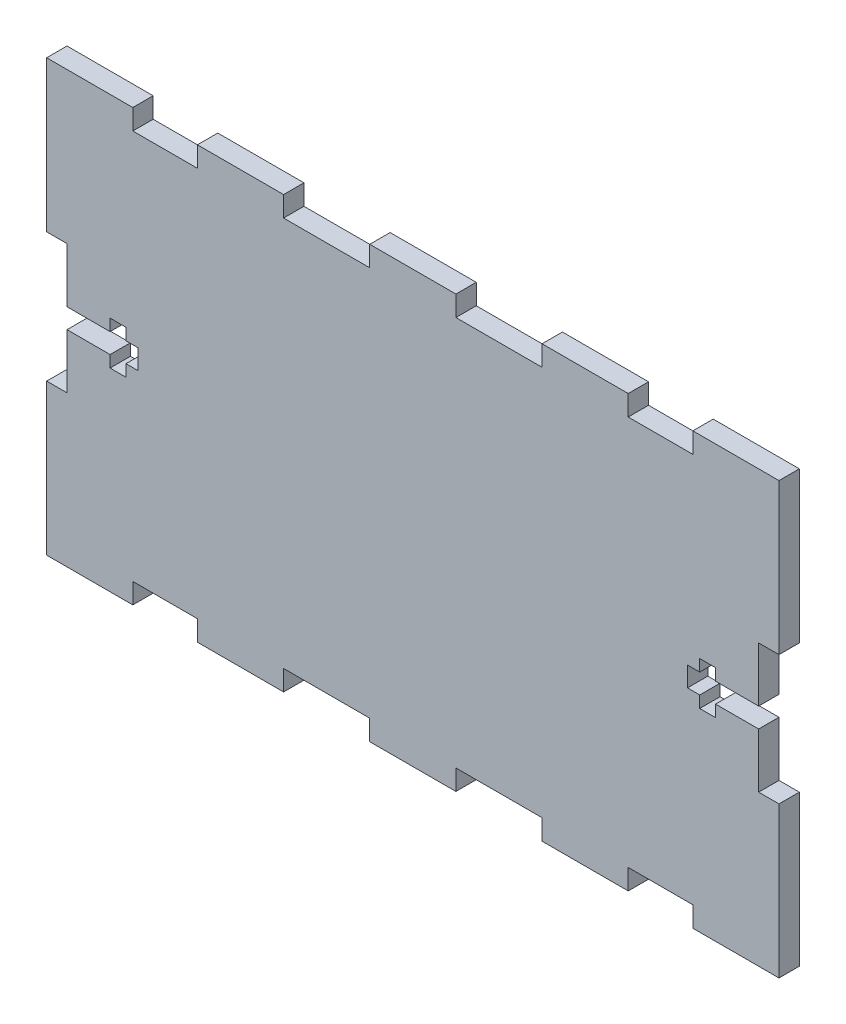
from build123d import *

# Parameters (mm, degrees)
SKETCH1_W           = 107.95
SKETCH1_H           = 63.5
BOSS_EXTRUDE1_DEPTH = 3
CUT_EXTRUDE1_REACH  = 127.278
SKETCH2_W           = 12.7
SKETCH2_H           = 3
SKETCH2_W_2         = 9.525
SKETCH2_W_3         = 3
SKETCH2_H_2         = 19.05
CUT_EXTRUDE2_REACH  = 127.278


with BuildPart() as part:
    # Sketch1 → Boss-Extrude1 (new body)
    with BuildSketch(Plane.XY):
        with Locations((53.975, 31.75)):
            Rectangle(SKETCH1_W, SKETCH1_H)
    extrude(amount=BOSS_EXTRUDE1_DEPTH)

    # Sketch2 → Cut-Extrude1 (cut, up to next)
    with BuildSketch(Plane(origin=(0, 0, 0), x_dir=(-1, 0, 0), z_dir=(0, 0, -1)), mode=Mode.PRIVATE) as cut_extrude1_sk1:
        with Locations((-66.675, 1.5)):
            Rectangle(SKETCH2_W, SKETCH2_H)
    cut_extrude1_tool1 = extrude(cut_extrude1_sk1.sketch, amount=-CUT_EXTRUDE1_REACH, mode=Mode.PRIVATE) & part.part
    # Sketch2 → Cut-Extrude1 (cut, up to next)
    with BuildSketch(Plane(origin=(0, 0, 0), x_dir=(-1, 0, 0), z_dir=(0, 0, -1)), mode=Mode.PRIVATE) as cut_extrude1_sk2:
        with Locations((-17.4625, 1.5)):
            Rectangle(SKETCH2_W_2, SKETCH2_H)
    cut_extrude1_tool2 = extrude(cut_extrude1_sk2.sketch, amount=-CUT_EXTRUDE1_REACH, mode=Mode.PRIVATE) & part.part
    # Sketch2 → Cut-Extrude1 (cut, up to next)
    with BuildSketch(Plane(origin=(0, 0, 0), x_dir=(-1, 0, 0), z_dir=(0, 0, -1)), mode=Mode.PRIVATE) as cut_extrude1_sk3:
        with Locations((-90.4875, 1.5)):
            Rectangle(SKETCH2_W_2, SKETCH2_H)
    cut_extrude1_tool3 = extrude(cut_extrude1_sk3.sketch, amount=-CUT_EXTRUDE1_REACH, mode=Mode.PRIVATE) & part.part
    # Sketch2 → Cut-Extrude1 (cut, up to next)
    with BuildSketch(Plane(origin=(0, 0, 0), x_dir=(-1, 0, 0), z_dir=(0, 0, -1)), mode=Mode.PRIVATE) as cut_extrude1_sk4:
        with Locations((-41.275, 1.5)):
            Rectangle(SKETCH2_W, SKETCH2_H)
    cut_extrude1_tool4 = extrude(cut_extrude1_sk4.sketch, amount=-CUT_EXTRUDE1_REACH, mode=Mode.PRIVATE) & part.part
    # Sketch2 → Cut-Extrude1 (cut, up to next)
    with BuildSketch(Plane(origin=(0, 0, 0), x_dir=(-1, 0, 0), z_dir=(0, 0, -1)), mode=Mode.PRIVATE) as cut_extrude1_sk5:
        with Locations((-41.275, 62)):
            Rectangle(SKETCH2_W, SKETCH2_H)
    cut_extrude1_tool5 = extrude(cut_extrude1_sk5.sketch, amount=-CUT_EXTRUDE1_REACH, mode=Mode.PRIVATE) & part.part
    # Sketch2 → Cut-Extrude1 (cut, up to next)
    with BuildSketch(Plane(origin=(0, 0, 0), x_dir=(-1, 0, 0), z_dir=(0, 0, -1)), mode=Mode.PRIVATE) as cut_extrude1_sk6:
        with Locations((-66.675, 62)):
            Rectangle(SKETCH2_W, SKETCH2_H)
    cut_extrude1_tool6 = extrude(cut_extrude1_sk6.sketch, amount=-CUT_EXTRUDE1_REACH, mode=Mode.PRIVATE) & part.part
    # Sketch2 → Cut-Extrude1 (cut, up to next)
    with BuildSketch(Plane(origin=(0, 0, 0), x_dir=(-1, 0, 0), z_dir=(0, 0, -1)), mode=Mode.PRIVATE) as cut_extrude1_sk7:
        with Locations((-17.4625, 62)):
            Rectangle(SKETCH2_W_2, SKETCH2_H)
    cut_extrude1_tool7 = extrude(cut_extrude1_sk7.sketch, amount=-CUT_EXTRUDE1_REACH, mode=Mode.PRIVATE) & part.part
    # Sketch2 → Cut-Extrude1 (cut, up to next)
    with BuildSketch(Plane(origin=(0, 0, 0), x_dir=(-1, 0, 0), z_dir=(0, 0, -1)), mode=Mode.PRIVATE) as cut_extrude1_sk8:
        with Locations((-106.45, 31.75)):
            Rectangle(SKETCH2_W_3, SKETCH2_H_2)
    cut_extrude1_tool8 = extrude(cut_extrude1_sk8.sketch, amount=-CUT_EXTRUDE1_REACH, mode=Mode.PRIVATE) & part.part
    # Sketch2 → Cut-Extrude1 (cut, up to next)
    with BuildSketch(Plane(origin=(0, 0, 0), x_dir=(-1, 0, 0), z_dir=(0, 0, -1)), mode=Mode.PRIVATE) as cut_extrude1_sk9:
        with Locations((-1.5, 31.75)):
            Rectangle(SKETCH2_W_3, SKETCH2_H_2)
    cut_extrude1_tool9 = extrude(cut_extrude1_sk9.sketch, amount=-CUT_EXTRUDE1_REACH, mode=Mode.PRIVATE) & part.part
    # Sketch2 → Cut-Extrude1 (cut, up to next)
    with BuildSketch(Plane(origin=(0, 0, 0), x_dir=(-1, 0, 0), z_dir=(0, 0, -1)), mode=Mode.PRIVATE) as cut_extrude1_sk10:
        with Locations((-90.4875, 62)):
            Rectangle(SKETCH2_W_2, SKETCH2_H)
    cut_extrude1_tool10 = extrude(cut_extrude1_sk10.sketch, amount=-CUT_EXTRUDE1_REACH, mode=Mode.PRIVATE) & part.part
    add(cut_extrude1_tool1.solids().sort_by_distance((66.675, 1.5, 0))[0], mode=Mode.SUBTRACT)
    add(cut_extrude1_tool2.solids().sort_by_distance((17.4625, 1.5, 0))[0], mode=Mode.SUBTRACT)
    add(cut_extrude1_tool3.solids().sort_by_distance((90.4875, 1.5, 0))[0], mode=Mode.SUBTRACT)
    add(cut_extrude1_tool4.solids().sort_by_distance((41.275, 1.5, 0))[0], mode=Mode.SUBTRACT)
    add(cut_extrude1_tool5.solids().sort_by_distance((41.275, 62, 0))[0], mode=Mode.SUBTRACT)
    add(cut_extrude1_tool6.solids().sort_by_distance((66.675, 62, 0))[0], mode=Mode.SUBTRACT)
    add(cut_extrude1_tool7.solids().sort_by_distance((17.4625, 62, 0))[0], mode=Mode.SUBTRACT)
    add(cut_extrude1_tool8.solids().sort_by_distance((106.45, 31.75, 0))[0], mode=Mode.SUBTRACT)
    add(cut_extrude1_tool9.solids().sort_by_distance((1.5, 31.75, 0))[0], mode=Mode.SUBTRACT)
    add(cut_extrude1_tool10.solids().sort_by_distance((90.4875, 62, 0))[0], mode=Mode.SUBTRACT)

    # Sketch3 → Cut-Extrude2 (cut, up to next)
    with BuildSketch(Plane(origin=(0, 0, 0), x_dir=(-1, 0, 0), z_dir=(0, 0, -1)), mode=Mode.PRIVATE) as cut_extrude2_sk1:
        Polygon((-3, 33.2105), (-9.35, 33.2105), (-9.35, 34.9377), (-11.6868, 34.9377), (-11.6868, 33.2105), (-13.49375, 33.2105), (-13.49375, 31.75), (-13.49375, 30.2895), (-11.6868, 30.2895), (-11.6868, 28.5623), (-9.35, 28.5623), (-9.35, 30.2895), (-3, 30.2895), (-3, 31.75), align=None)
    cut_extrude2_tool1 = extrude(cut_extrude2_sk1.sketch, amount=-CUT_EXTRUDE2_REACH, mode=Mode.PRIVATE) & part.part
    # Sketch3 → Cut-Extrude2 (cut, up to next)
    with BuildSketch(Plane(origin=(0, 0, 0), x_dir=(-1, 0, 0), z_dir=(0, 0, -1)), mode=Mode.PRIVATE) as cut_extrude2_sk2:
        Polygon((-94.45625, 30.2895), (-94.45625, 31.75), (-94.45625, 33.2105), (-96.2632, 33.2105), (-96.2632, 34.9377), (-98.6, 34.9377), (-98.6, 33.2105), (-104.95, 33.2105), (-104.95, 31.75), (-104.95, 30.2895), (-98.6, 30.2895), (-98.6, 28.5623), (-96.2632, 28.5623), (-96.2632, 30.2895), align=None)
    cut_extrude2_tool2 = extrude(cut_extrude2_sk2.sketch, amount=-CUT_EXTRUDE2_REACH, mode=Mode.PRIVATE) & part.part
    add(cut_extrude2_tool1.solids().sort_by_distance((8.720382, 31.75, 0))[0], mode=Mode.SUBTRACT)
    add(cut_extrude2_tool2.solids().sort_by_distance((99.229618, 31.75, 0))[0], mode=Mode.SUBTRACT)


solid = part.part
